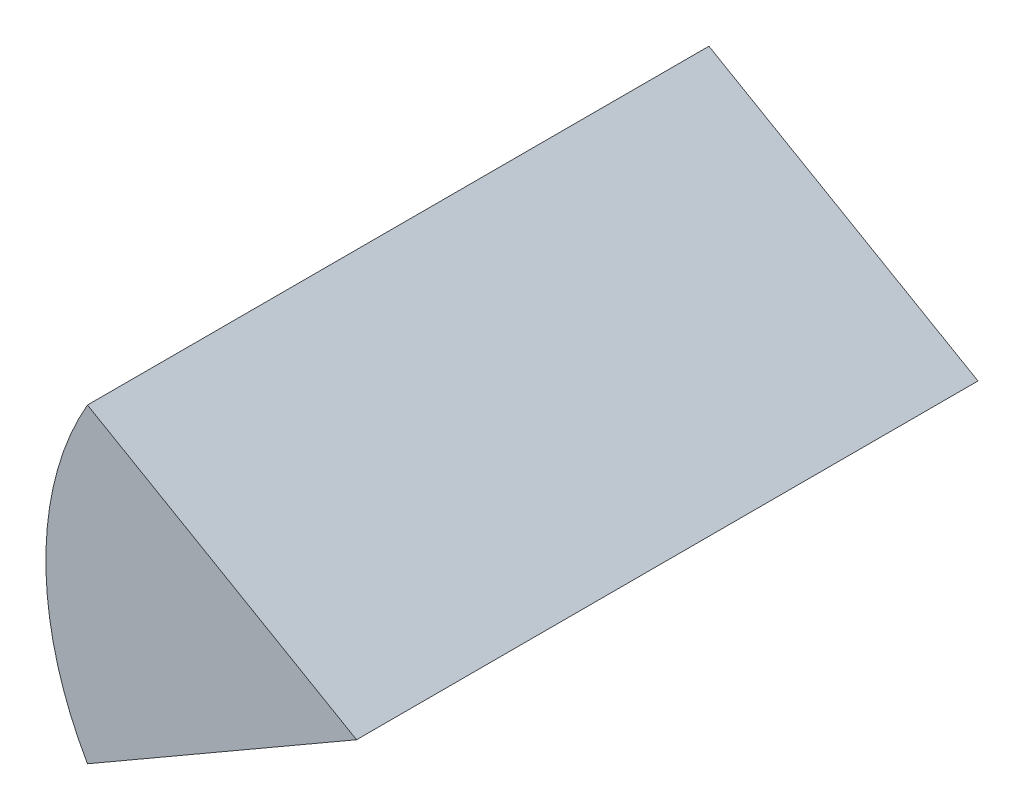
from build123d import *

# Parameters (mm, degrees)
SALIENTE_EXTRUIR1_DEPTH = 50
CROQUIS2_R              = 5
CORTAR_EXTRUIR1_DEPTH   = 10


with BuildPart() as part:
    # Croquis1 → Saliente-Extruir1 (new body)
    with BuildSketch(Plane.XY):
        with BuildLine():
            Line((0, 0), (-21.650635095, 12.5))
            ThreePointArc((-21.650635095, 12.5), (-25, 0), (-21.650635095, -12.5))
            Line((-21.650635095, -12.5), (0, 0))
        make_face()
    extrude(amount=SALIENTE_EXTRUIR1_DEPTH)

    # Croquis2 → Cortar-Extruir1 (cut)
    with BuildSketch(Plane(origin=(0, 0, 0), x_dir=(-1, 0, 0), z_dir=(0, 0, -1))):
        with Locations((15.771493546, 0)):
            Circle(CROQUIS2_R)
    extrude(amount=-CORTAR_EXTRUIR1_DEPTH, mode=Mode.SUBTRACT)


solid = part.part
